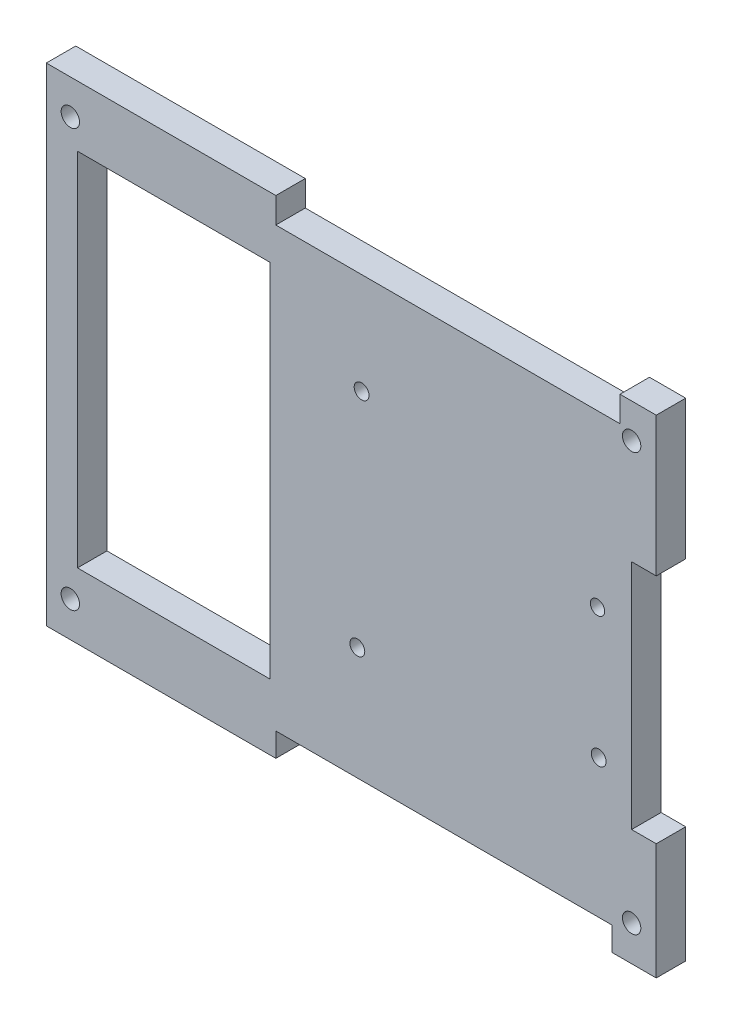
from build123d import *

# Parameters (mm, degrees)
SKETCH1_W                    = 131.490901353
SKETCH1_H                    = 105.083375897
SKETCH1_R                    = 1.9812
BASE_PLATE_DEPTH             = 6.35
SKETCH2_R                    = 1.6
SKETCH2_R_2                  = 1.540770003
ARDUINO_MOUNTING_HOLES_DEPTH = 6.35
SKETCH3_W                    = 41.532415145
SKETCH3_H                    = 77.800157949
CABLE_OPENING_DEPTH          = 6.35
SKETCH4_W                    = 74.20112143
SKETCH4_H                    = 5.509329328
SKETCH4_W_2                  = 72.501511829
SKETCH4_H_2                  = 5.116757241
SKETCH4_W_3                  = 5.306940646
SKETCH4_H_3                  = 50.003346063
CUT_EXTRUDE3_DEPTH           = 6.35


with BuildPart() as part:
    # Sketch1 → Base_Plate (new body)
    with BuildSketch(Plane.XY.offset(1332.023843603)):
        with Locations((483.923899553, 868.728663849)):
            Rectangle(SKETCH1_W, SKETCH1_H)
        with Locations((423.356809583, 913.820206664)):
            Circle(SKETCH1_R, mode=Mode.SUBTRACT)
        with Locations((544.362409583, 913.820206664)):
            Circle(SKETCH1_R, mode=Mode.SUBTRACT)
        with Locations((544.362409583, 823.802606664)):
            Circle(SKETCH1_R, mode=Mode.SUBTRACT)
        with Locations((423.356809583, 823.802606664)):
            Circle(SKETCH1_R, mode=Mode.SUBTRACT)
    extrude(amount=BASE_PLATE_DEPTH)

    # Sketch2 → Arduino_Mounting_Holes (cut)
    with BuildSketch(Plane.XY.offset(1338.373843603)):
        with Locations((486.149027751, 893.958307234)):
            Circle(SKETCH2_R)
        with Locations((537.005692703, 879.063667595)):
            Circle(SKETCH2_R_2)
        with Locations((537.262931981, 851.150350094)):
            Circle(SKETCH2_R)
        with Locations((485.231408993, 845.690321199)):
            Circle(SKETCH2_R)
    extrude(amount=-ARDUINO_MOUNTING_HOLES_DEPTH, mode=Mode.SUBTRACT)

    # Sketch3 → Cable_Opening (cut)
    with BuildSketch(Plane.XY.offset(1338.373843603)):
        with Locations((445.669830045, 869.267134618)):
            Rectangle(SKETCH3_W, SKETCH3_H)
    extrude(amount=-CABLE_OPENING_DEPTH, mode=Mode.SUBTRACT)

    # Sketch4 → Cut-Extrude3 (cut)
    with BuildSketch(Plane.XY.offset(1338.373843603)):
        with Locations((504.759181332, 918.515687133)):
            Rectangle(SKETCH4_W, SKETCH4_H)
        with Locations((503.90881977, 818.745354521)):
            Rectangle(SKETCH4_W_2, SKETCH4_H_2)
        with Locations((547.015879906, 866.253246095)):
            Rectangle(SKETCH4_W_3, SKETCH4_H_3)
    extrude(amount=-CUT_EXTRUDE3_DEPTH, mode=Mode.SUBTRACT)


solid = part.part
